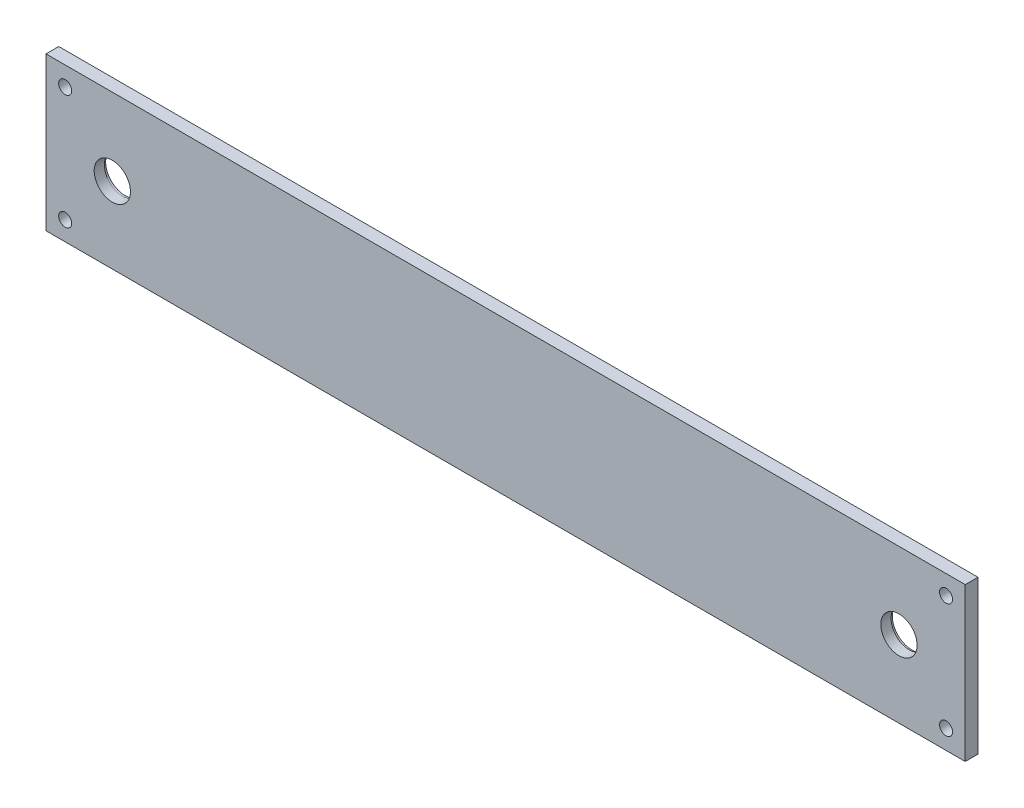
from build123d import *

# Parameters (mm, degrees)
SKETCH1_W           = 360
SKETCH1_H           = 60
SKETCH1_R           = 7.1
BOSS_EXTRUDE1_DEPTH = 4
SKETCH2_W           = 360
SKETCH2_H           = 60
SKETCH2_R           = 7.6
BOSS_EXTRUDE2_DEPTH = 1
CUT_EXTRUDE1_REACH  = 337.423
SKETCH3_R           = 2.55


with BuildPart() as part:
    # Sketch1 → Boss-Extrude1 (new body)
    with BuildSketch(Plane.XY):
        with Locations((-154.041275094, 0)):
            Rectangle(SKETCH1_W, SKETCH1_H)
        Circle(SKETCH1_R, mode=Mode.SUBTRACT)
        with Locations((-308.082550187, -0.2)):
            Circle(SKETCH1_R, mode=Mode.SUBTRACT)
    extrude(amount=-BOSS_EXTRUDE1_DEPTH)

    # Sketch2 → Boss-Extrude2 (add)
    with BuildSketch(Plane(origin=(0, 0, -4), x_dir=(-1, 0, 0), z_dir=(0, 0, -1))):
        with Locations((154.041275094, 0)):
            Rectangle(SKETCH2_W, SKETCH2_H)
        Circle(SKETCH2_R, mode=Mode.SUBTRACT)
        with Locations(Location((308.082550187, 0, 0), (0, 0, 180))):
            Circle(SKETCH2_R, mode=Mode.SUBTRACT)
    extrude(amount=BOSS_EXTRUDE2_DEPTH)

    # Sketch3 → Cut-Extrude1 (cut, up to next)
    with BuildSketch(Plane(origin=(0, 0, -5), x_dir=(-1, 0, 0), z_dir=(0, 0, -1)), mode=Mode.PRIVATE) as cut_extrude1_sk1:
        with Locations((326.53392807, -22.492652976)):
            Circle(SKETCH3_R)
    cut_extrude1_tool1 = extrude(cut_extrude1_sk1.sketch, amount=-CUT_EXTRUDE1_REACH, mode=Mode.PRIVATE) & part.part
    # Sketch3 → Cut-Extrude1 (cut, up to next)
    with BuildSketch(Plane(origin=(0, 0, -5), x_dir=(-1, 0, 0), z_dir=(0, 0, -1)), mode=Mode.PRIVATE) as cut_extrude1_sk2:
        with Locations((326.53392807, 22.492652976)):
            Circle(SKETCH3_R)
    cut_extrude1_tool2 = extrude(cut_extrude1_sk2.sketch, amount=-CUT_EXTRUDE1_REACH, mode=Mode.PRIVATE) & part.part
    # Sketch3 → Cut-Extrude1 (cut, up to next)
    with BuildSketch(Plane(origin=(0, 0, -5), x_dir=(-1, 0, 0), z_dir=(0, 0, -1)), mode=Mode.PRIVATE) as cut_extrude1_sk3:
        with Locations(Location((-18.451377883, -22.492652976, 0), (0, 0, 180))):
            Circle(SKETCH3_R)
    cut_extrude1_tool3 = extrude(cut_extrude1_sk3.sketch, amount=-CUT_EXTRUDE1_REACH, mode=Mode.PRIVATE) & part.part
    # Sketch3 → Cut-Extrude1 (cut, up to next)
    with BuildSketch(Plane(origin=(0, 0, -5), x_dir=(-1, 0, 0), z_dir=(0, 0, -1)), mode=Mode.PRIVATE) as cut_extrude1_sk4:
        with Locations((-18.451377883, 22.492652976)):
            Circle(SKETCH3_R)
    cut_extrude1_tool4 = extrude(cut_extrude1_sk4.sketch, amount=-CUT_EXTRUDE1_REACH, mode=Mode.PRIVATE) & part.part
    add(cut_extrude1_tool1.solids().sort_by_distance((-326.533928, -22.492653, -5))[0], mode=Mode.SUBTRACT)
    add(cut_extrude1_tool2.solids().sort_by_distance((-326.533928, 22.492653, -5))[0], mode=Mode.SUBTRACT)
    add(cut_extrude1_tool3.solids().sort_by_distance((18.451378, -22.492653, -5))[0], mode=Mode.SUBTRACT)
    add(cut_extrude1_tool4.solids().sort_by_distance((18.451378, 22.492653, -5))[0], mode=Mode.SUBTRACT)


solid = part.part
